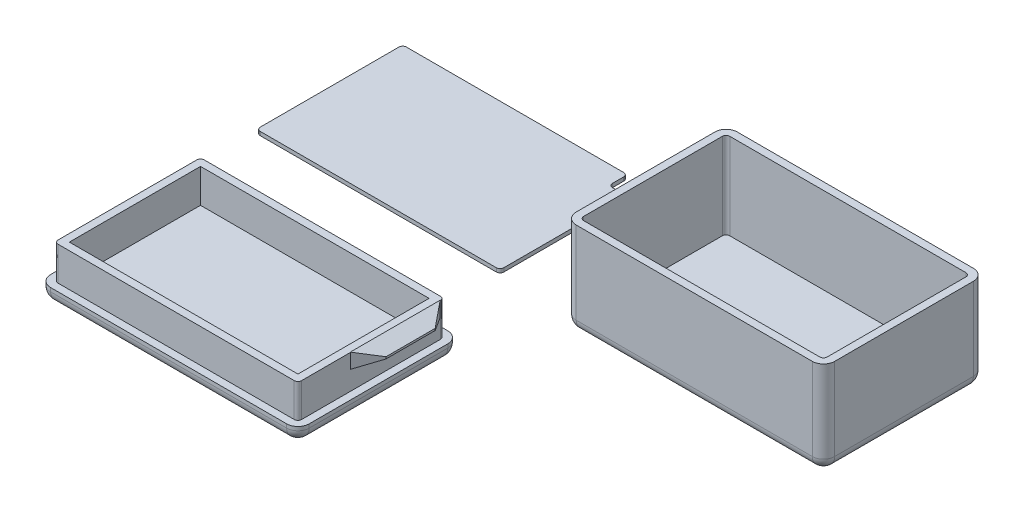
from build123d import *

# Parameters (mm, degrees)
BOSS_EXTRUDE1_DEPTH   = 1
FILLET2_R             = 1
FILLET3_R             = 1
FILLET4_R             = 1
FILLET5_R             = 1
SKETCH3_W             = 69
SKETCH3_H             = 43
SKETCH3_W_2           = 65
SKETCH3_H_2           = 39
BOSS_EXTRUDE2_DEPTH   = 23
SKETCH5_W             = 69
SKETCH5_H             = 43
BOSS_EXTRUDE3_DEPTH   = 2
FILLET6_R             = 1
FILLET7_R             = 1
FILLET8_R             = 1
FILLET9_R             = 1
FILLET10_R            = 3
FILLET11_R            = 3
BOSS_EXTRUDE5_DEPTH   = 9
FILLET12_R            = 1
FILLET13_R            = 1
BOSS_EXTRUDE6_DEPTH   = 4
SKETCH9_W             = 61
SKETCH9_H             = 35
BOSS_EXTRUDE7_DEPTH   = 9
FILLET14_R            = 3
FILLET15_R            = 3
BOSS_EXTRUDE8_DEPTH   = 24
BOSS_EXTRUDE9_DEPTH   = 4
BOSS_EXTRUDE9_2_DEPTH = 4


with BuildPart() as part:
    # Sketch1 → Boss-Extrude1 (new body)
    with BuildSketch(Plane(origin=(0, 0, 0), x_dir=(1, 0, 0), z_dir=(0, 1, 0))):
        Polygon((-58.370860927, -20.40397351), (-58.370860927, 18.59602649), (1.629139073, 18.59602649), (1.629139073, 13.59602649), (6.629139073, 13.59602649), (6.629139073, -20.40397351), align=None)
    extrude(amount=BOSS_EXTRUDE1_DEPTH)

    # Fillet2
    fillet2_edges = [part.edges().sort_by_distance(p)[0] for p in [
        (6.629139073, 0.5, 20.40397351),
    ]]
    fillet(fillet2_edges, radius=FILLET2_R)

    # Fillet3
    fillet3_edges = [part.edges().sort_by_distance(p)[0] for p in [
        (1.629139073, 0.5, -18.59602649),
        (1.629139073, 0.5, -13.59602649),
        (6.629139073, 0.5, -13.59602649),
    ]]
    fillet(fillet3_edges, radius=FILLET3_R)

    # Fillet4
    fillet4_edges = [part.edges().sort_by_distance(p)[0] for p in [
        (-58.370860927, 0.5, -18.59602649),
    ]]
    fillet(fillet4_edges, radius=FILLET4_R)

    # Fillet5
    fillet5_edges = [part.edges().sort_by_distance(p)[0] for p in [
        (-58.370860927, 0.5, 20.40397351),
    ]]
    fillet(fillet5_edges, radius=FILLET5_R)


with BuildPart() as body_2:
    # Sketch3 → Boss-Extrude2 (new body)
    with BuildSketch(Plane.XZ):
        with Locations((59.917093339, 0.378619439)):
            Rectangle(SKETCH3_W, SKETCH3_H)
        with Locations((59.917093339, 0.378619439)):
            Rectangle(SKETCH3_W_2, SKETCH3_H_2, mode=Mode.SUBTRACT)
    extrude(amount=-BOSS_EXTRUDE2_DEPTH)

    # Sketch5 → Boss-Extrude3 (add)
    with BuildSketch(Plane.XZ):
        with Locations((59.917093339, 0.378619439)):
            Rectangle(SKETCH5_W, SKETCH5_H)
    extrude(amount=BOSS_EXTRUDE3_DEPTH)

    # Fillet6
    fillet6_edges = [body_2.edges().sort_by_distance(p)[0] for p in [
        (27.417093339, 11.5, 19.878619439),
    ]]
    fillet(fillet6_edges, radius=FILLET6_R)

    # Fillet7
    fillet7_edges = [body_2.edges().sort_by_distance(p)[0] for p in [
        (27.417093339, 11.5, -19.121380561),
    ]]
    fillet(fillet7_edges, radius=FILLET7_R)

    # Fillet8
    fillet8_edges = [body_2.edges().sort_by_distance(p)[0] for p in [
        (92.417093339, 11.5, -19.121380561),
    ]]
    fillet(fillet8_edges, radius=FILLET8_R)

    # Fillet9
    fillet9_edges = [body_2.edges().sort_by_distance(p)[0] for p in [
        (92.417093339, 11.5, 19.878619439),
    ]]
    fillet(fillet9_edges, radius=FILLET9_R)

    # Fillet10
    fillet10_edges = [body_2.edges().sort_by_distance(p)[0] for p in [
        (94.417093339, 10.5, -21.121380561),
        (25.417093339, 10.5, -21.121380561),
        (94.417093339, 10.5, 21.878619439),
    ]]
    fillet(fillet10_edges, radius=FILLET10_R)

    # Fillet11
    fillet11_edges = [body_2.edges().sort_by_distance(p)[0] for p in [
        (25.417093339, 10.5, 21.878619439),
    ]]
    fillet(fillet11_edges, radius=FILLET11_R)

    # Fillet14
    fillet14_edges = [body_2.edges().sort_by_distance(p)[0] for p in [
        (94.417093339, -2, 0.378619439),
        (59.917093339, -2, -21.121380561),
        (59.917093339, -2, 21.878619439),
        (93.538413683, -2, -20.242700905),
        (26.295772995, -2, -20.242700905),
        (93.538413683, -2, 20.999939782),
        (25.417093339, -2, 0.378619439),
        (26.295772995, -2, 20.999939782),
    ]]
    fillet(fillet14_edges, radius=FILLET14_R)


with BuildPart() as body_3:
    # Sketch7 → Boss-Extrude5 (new body)
    with BuildSketch(Plane(origin=(-22.905465396, 1, 42.53872145), x_dir=(1, 0, 0), z_dir=(0, 1, 0))):
        Polygon((-36.359783771, -30.922325969), (-36.359783771, 8.077674031), (23.640216229, 8.077674031), (28.640216229, 8.077674031), (28.640216229, 3.077674031), (28.640216229, -30.922325969), align=None)
    extrude(amount=-BOSS_EXTRUDE5_DEPTH)

    # Fillet12
    fillet12_edges = [body_3.edges().sort_by_distance(p)[0] for p in [
        (5.734750833, -3.5, 34.461047419),
        (5.734750833, -3.5, 73.461047419),
    ]]
    fillet(fillet12_edges, radius=FILLET12_R)

    # Fillet13
    fillet13_edges = [body_3.edges().sort_by_distance(p)[0] for p in [
        (-59.265249167, -3.5, 73.461047419),
        (-59.265249167, -3.5, 34.461047419),
    ]]
    fillet(fillet13_edges, radius=FILLET13_R)

    # Sketch8 → Boss-Extrude6 (add)
    with BuildSketch(Plane(origin=(0, -8, 0), x_dir=(-1, 0, 0), z_dir=(0, -1, 0))):
        with BuildLine():
            Line((58.265249167, -32.461047419), (-4.734750833, -32.461047419))
            ThreePointArc((-4.734750833, -32.461047419), (-6.856071177, -33.339727075), (-7.734750833, -35.461047419))
            Line((-7.734750833, -35.461047419), (-7.734750833, -72.461047419))
            ThreePointArc((-7.734750833, -72.461047419), (-6.856071177, -74.582367762), (-4.734750833, -75.461047419))
            Line((-4.734750833, -75.461047419), (58.265249167, -75.461047419))
            ThreePointArc((58.265249167, -75.461047419), (60.38656951, -74.582367762), (61.265249167, -72.461047419))
            Line((61.265249167, -72.461047419), (61.265249167, -35.461047419))
            ThreePointArc((61.265249167, -35.461047419), (60.38656951, -33.339727075), (58.265249167, -32.461047419))
        make_face()
    extrude(amount=BOSS_EXTRUDE6_DEPTH)


with BuildPart() as body_4:
    # Sketch9 → Boss-Extrude7 (new body)
    with BuildSketch(Plane(origin=(0, 1, 0), x_dir=(1, 0, 0), z_dir=(0, 1, 0))):
        with Locations((-26.765249167, -53.961047419)):
            Rectangle(SKETCH9_W, SKETCH9_H)
    extrude(amount=-BOSS_EXTRUDE7_DEPTH)


with BuildPart() as body_3_1:
    add(body_3.part)

    # Combine1: cut body 4
    add(body_4.part, mode=Mode.SUBTRACT)

    # Fillet15
    fillet15_edges = [body_3_1.edges().sort_by_distance(p)[0] for p in [
        (-60.38656951, -12, 33.339727075),
        (-26.765249167, -12, 32.461047419),
        (6.856071177, -12, 33.339727075),
        (7.734750833, -12, 53.961047419),
        (6.856071177, -12, 74.582367762),
        (-26.765249167, -12, 75.461047419),
        (-60.38656951, -12, 74.582367762),
        (-61.265249167, -12, 53.961047419),
    ]]
    fillet(fillet15_edges, radius=FILLET15_R)


with BuildPart() as body_4_2:
    # Sketch12 → Boss-Extrude8 (new body)
    with BuildSketch(Plane.XY.offset(55.17585305)):
        Polygon((25.417093339, 20.776561778), (25.417093339, 16.776561778), (29.511035961, 18.518502263), (29.511035961, 19.034621293), align=None)
    extrude(amount=BOSS_EXTRUDE8_DEPTH)


with BuildPart() as body_5:
    # Sketch15 → Boss-Extrude9 (new body)
    with BuildSketch(Plane(origin=(0, 20.776561778, 0), x_dir=(1, 0, 0), z_dir=(0, 1, 0))):
        Polygon((25.417093339, -79.17585305), (29.511035961, -73.74092263), (29.511035961, -79.17585305), align=None)
    extrude(amount=-BOSS_EXTRUDE9_DEPTH)


with BuildPart() as body_6:
    # Sketch15 → Boss-Extrude9 2 (new body)
    with BuildSketch(Plane(origin=(0, 20.776561778, 0), x_dir=(1, 0, 0), z_dir=(0, 1, 0))):
        Polygon((29.511035961, -60.610783469), (29.511035961, -55.17585305), (25.417093339, -55.17585305), align=None)
    extrude(amount=-BOSS_EXTRUDE9_2_DEPTH)


with BuildPart() as body_4_2_1:
    add(body_4_2.part)

    # Combine2: cut body 5, body 6
    add(body_5.part, mode=Mode.SUBTRACT)
    add(body_6.part, mode=Mode.SUBTRACT)


solid = Compound([part.part, body_2.part, body_3_1.part, body_4_2_1.part])
